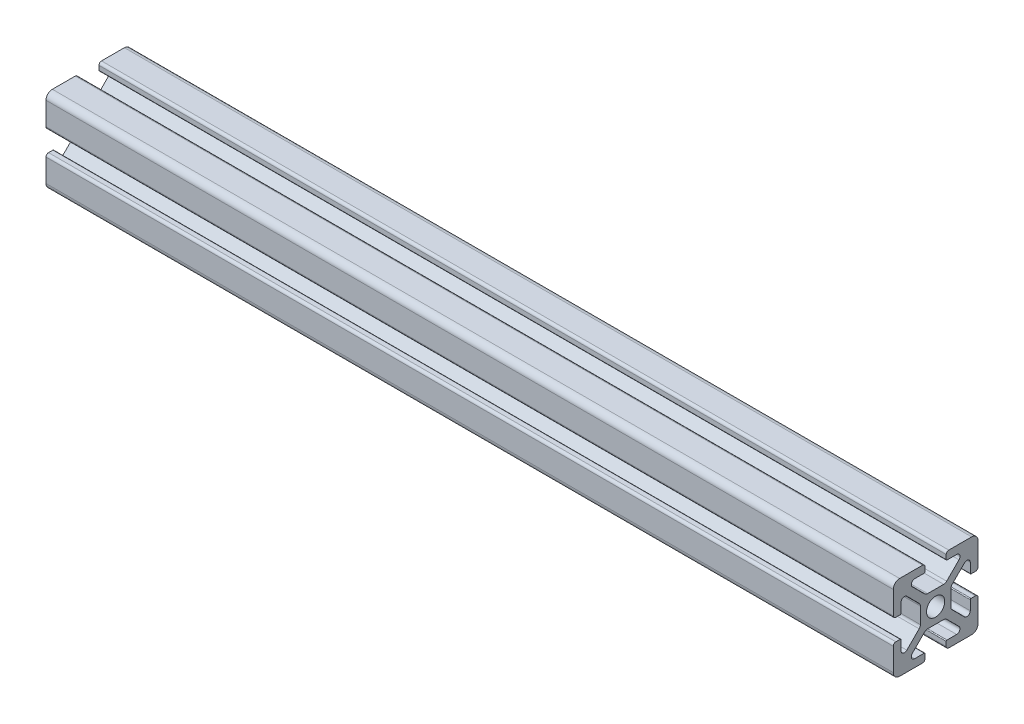
from build123d import *

# Parameters (mm, degrees)
BOSS_EXTRUDE1_DEPTH      = 100
BOSS_EXTRUDE1_DEPTH_BACK = 100


with BuildPart() as part:
    # Sketch3 → Boss-Extrude1 (new, two sides: drawn at the far end of the back side and taken through both)
    with BuildSketch(Plane(origin=(0, 0, 0), x_dir=(0, 0, -1), z_dir=(1, 0, 0)).offset(-BOSS_EXTRUDE1_DEPTH_BACK)):
        with BuildLine():
            Line((-5.515685425, 6.807463915), (-2.601114729, 3.892893219))
            ThreePointArc((-2.601114729, 3.892893219), (-2.27669138, 3.676120467), (-1.894007948, 3.6))
            Line((-1.894007948, 3.6), (0, 3.6))
            Line((0, 3.6), (0, 2.15))
            ThreePointArc((0, 2.15), (-1.52027958, 1.52027958), (-2.15, 0))
            Line((-2.15, 0), (-3.6, 0))
            Line((-3.6, 0), (-3.6, 1.894007948))
            ThreePointArc((-3.6, 1.894007948), (-3.676120467, 2.27669138), (-3.892893219, 2.601114729))
            Line((-3.892893219, 2.601114729), (-6.807463915, 5.515685425))
            ThreePointArc((-6.807463915, 5.515685425), (-7.679296086, 5.689103626), (-8.17314934, 4.95))
            Line((-8.17314934, 4.95), (-8.17314934, 2.7))
            ThreePointArc((-8.17314934, 2.7), (-8.231727984, 2.558578644), (-8.37314934, 2.5))
            Line((-8.37314934, 2.5), (-9.4, 2.5))
            ThreePointArc((-9.4, 2.5), (-9.824264069, 2.675735931), (-10, 3.1))
            Line((-10, 3.1), (-10, 8.5))
            ThreePointArc((-10, 8.5), (-9.560660172, 9.560660172), (-8.5, 10))
            Line((-8.5, 10), (-3.1, 10))
            ThreePointArc((-3.1, 10), (-2.675735931, 9.824264069), (-2.5, 9.4))
            Line((-2.5, 9.4), (-2.5, 8.37314934))
            ThreePointArc((-2.5, 8.37314934), (-2.558578644, 8.231727984), (-2.7, 8.17314934))
            Line((-2.7, 8.17314934), (-4.95, 8.17314934))
            ThreePointArc((-4.95, 8.17314934), (-5.689103626, 7.679296086), (-5.515685425, 6.807463915))
        make_face()
    extrude(amount=BOSS_EXTRUDE1_DEPTH + BOSS_EXTRUDE1_DEPTH_BACK)

    # Mirror1: part across plane


with BuildPart() as part_1:
    add(part.part)
    add(part.part.mirror(Plane.ZX))

    # Mirror2: part across plane


with BuildPart() as part_2:
    add(part_1.part)
    add(part_1.part.mirror(Plane.XY))


solid = part_2.part
